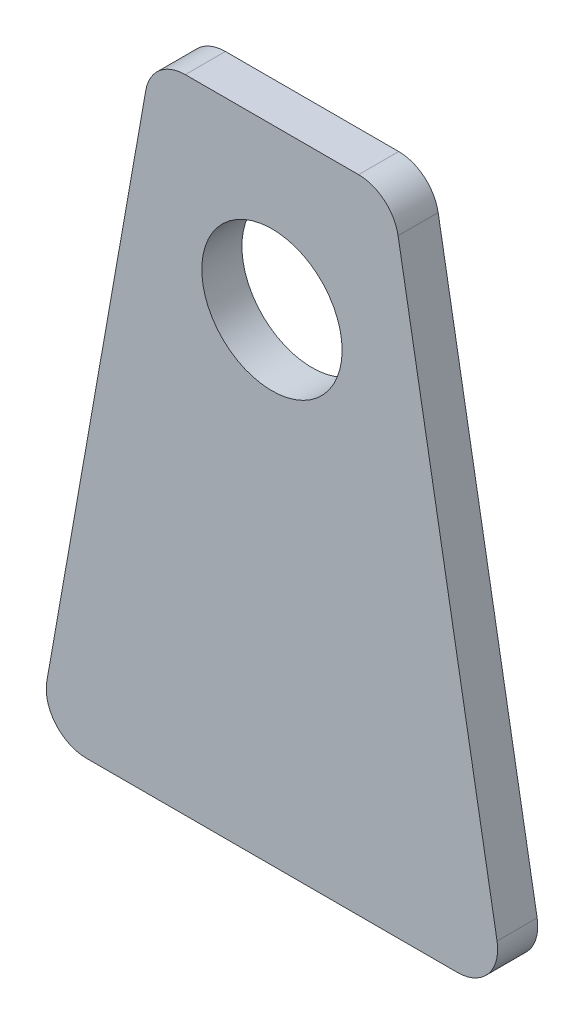
from build123d import *

# Parameters (mm, degrees)
LAYOUT_R            = 11.1125
BOSS_EXTRUDE1_DEPTH = 6.35


with BuildPart() as part:
    # Layout → Boss-Extrude1 (new body)
    with BuildSketch(Plane.XY):
        with BuildLine():
            Line((1.314106081, 7.452665928), (16.989574666, 96.352665928))
            ThreePointArc((16.989574666, 96.352665928), (19.161402576, 100.114382214), (23.243103898, 101.6))
            Line((23.243103898, 101.6), (50.686538582, 101.6))
            ThreePointArc((50.686538582, 101.6), (54.768239904, 100.114382214), (56.940067814, 96.352665928))
            Line((56.940067814, 96.352665928), (72.615536399, 7.452665928))
            ThreePointArc((72.615536399, 7.452665928), (71.226389381, 2.268298678), (66.362007167, 0))
            Line((66.362007167, 0), (7.567635313, 0))
            ThreePointArc((7.567635313, 0), (2.703253099, 2.268298678), (1.314106081, 7.452665928))
        make_face()
        with Locations((36.96482124, 76.2)):
            Circle(LAYOUT_R, mode=Mode.SUBTRACT)
    extrude(amount=BOSS_EXTRUDE1_DEPTH)


solid = part.part
